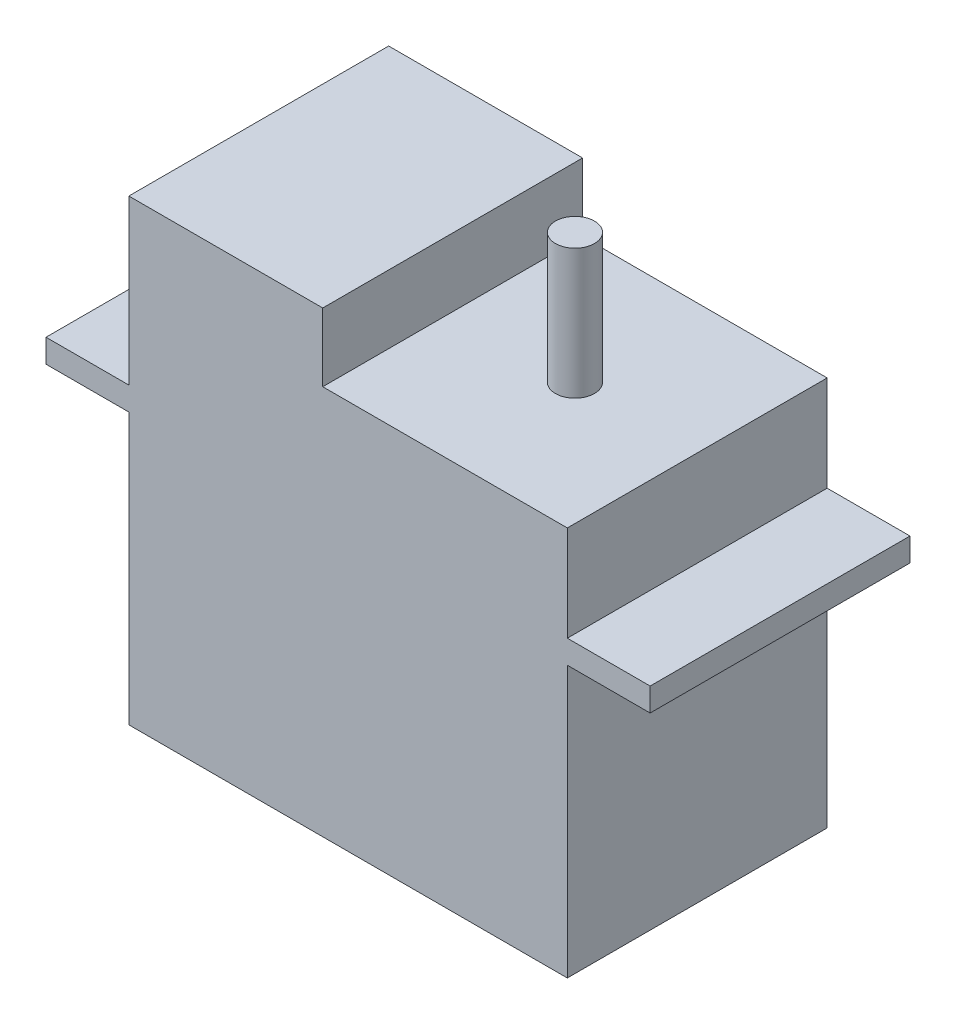
from build123d import *

# Parameters (mm, degrees)
BOSS_EXTRU_1_DEPTH      = 10
BOSS_EXTRU_1_DEPTH_BACK = 10
ESQUISSE3_R             = 1.5
BOSS_EXTRU_2_DEPTH      = 10


with BuildPart() as part:
    # Esquisse1 → Boss.-Extru.1 (new, two sides: drawn at the far end of the back side and taken through both)
    with BuildSketch(Plane.XY.offset(-BOSS_EXTRU_1_DEPTH_BACK)):
        Polygon((0, 0), (33.75, 0), (33.75, 20.85), (40.125, 20.85), (40.125, 22.65), (33.75, 22.65), (33.75, 30), (14.925, 30), (14.925, 35.25), (0, 35.25), (0, 22.65), (-6.375, 22.65), (-6.375, 20.85), (0, 20.85), align=None)
    extrude(amount=BOSS_EXTRU_1_DEPTH + BOSS_EXTRU_1_DEPTH_BACK)

    # Esquisse3 → Boss.-Extru.2 (add)
    with BuildSketch(Plane(origin=(0, 30, 0), x_dir=(1, 0, 0), z_dir=(0, 1, 0))):
        with Locations((24.3375, 0)):
            Circle(ESQUISSE3_R)
    extrude(amount=BOSS_EXTRU_2_DEPTH)


solid = part.part
